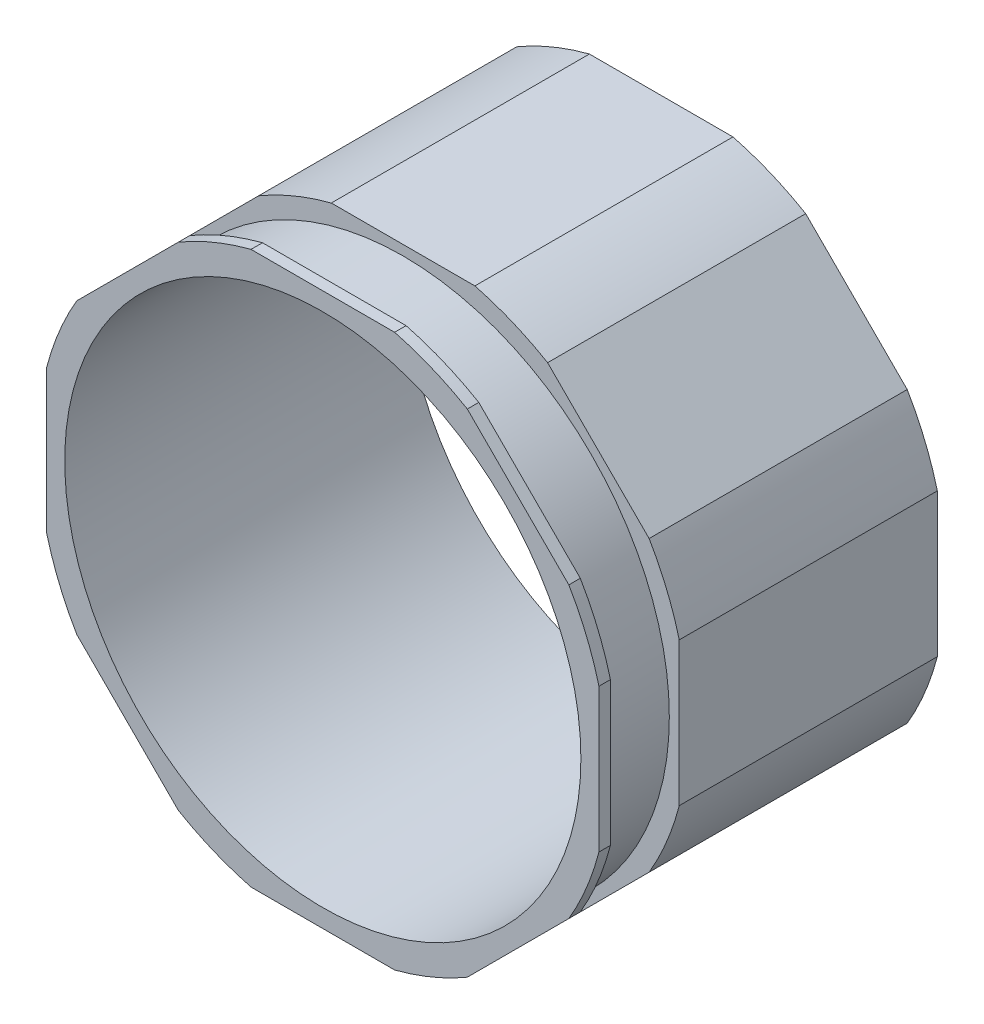
from build123d import *

# Parameters (mm, degrees)
SKETCH1_R           = 114.3
BOSS_EXTRUDE1_DEPTH = 114.3
SKETCH2_R           = 117.9068
SKETCH2_R_2         = 114.3
BOSS_EXTRUDE2_DEPTH = 30.48
SKETCH3_R           = 114.3
BOSS_EXTRUDE3_DEPTH = 5.08


with BuildPart() as part:
    # Sketch1 → Boss-Extrude1 (new body)
    with BuildSketch(Plane.XY):
        with BuildLine():
            ThreePointArc((-31.793446259, 122.3), (-48.357791931, 116.746037126), (-63.997797892, 108.960520786))
            Line((-63.997797892, 108.960520786), (-108.960520786, 63.997797892))
            ThreePointArc((-108.960520786, 63.997797892), (-116.746037126, 48.357791931), (-122.3, 31.793446259))
            Line((-122.3, 31.793446259), (-122.3, -31.793446259))
            ThreePointArc((-122.3, -31.793446259), (-116.746037126, -48.357791931), (-108.960520786, -63.997797892))
            Line((-108.960520786, -63.997797892), (-63.997797892, -108.960520786))
            ThreePointArc((-63.997797892, -108.960520786), (-48.357791931, -116.746037126), (-31.793446259, -122.3))
            Line((-31.793446259, -122.3), (31.793446259, -122.3))
            ThreePointArc((31.793446259, -122.3), (48.357791931, -116.746037126), (63.997797892, -108.960520786))
            Line((63.997797892, -108.960520786), (108.960520786, -63.997797892))
            ThreePointArc((108.960520786, -63.997797892), (116.746037126, -48.357791931), (122.3, -31.793446259))
            Line((122.3, -31.793446259), (122.3, 31.793446259))
            ThreePointArc((122.3, 31.793446259), (116.746037126, 48.357791931), (108.960520786, 63.997797892))
            Line((108.960520786, 63.997797892), (63.997797892, 108.960520786))
            ThreePointArc((63.997797892, 108.960520786), (48.357791931, 116.746037126), (31.793446259, 122.3))
            Line((31.793446259, 122.3), (-31.793446259, 122.3))
        make_face()
        Circle(SKETCH1_R, mode=Mode.SUBTRACT)
    extrude(amount=BOSS_EXTRUDE1_DEPTH)

    # Sketch2 → Boss-Extrude2 (add)
    with BuildSketch(Plane.XY.offset(114.3)):
        with Locations(Location((0, 0, 0), (0, 0, 180))):
            Circle(SKETCH2_R)
        Circle(SKETCH2_R_2, mode=Mode.SUBTRACT)
    extrude(amount=BOSS_EXTRUDE2_DEPTH)

    # Sketch3 → Boss-Extrude3 (add)
    with BuildSketch(Plane.XY.offset(144.78)):
        with BuildLine():
            Line((122.3, -31.793446259), (122.3, 31.793446259))
            ThreePointArc((122.3, 31.793446259), (116.746037126, 48.357791931), (108.960520786, 63.997797892))
            Line((108.960520786, 63.997797892), (63.997797892, 108.960520786))
            ThreePointArc((63.997797892, 108.960520786), (48.357791931, 116.746037126), (31.793446259, 122.3))
            Line((31.793446259, 122.3), (-31.793446259, 122.3))
            ThreePointArc((-31.793446259, 122.3), (-48.357791931, 116.746037126), (-63.997797892, 108.960520786))
            Line((-63.997797892, 108.960520786), (-108.960520786, 63.997797892))
            ThreePointArc((-108.960520786, 63.997797892), (-116.746037126, 48.357791931), (-122.3, 31.793446259))
            Line((-122.3, 31.793446259), (-122.3, -31.793446259))
            ThreePointArc((-122.3, -31.793446259), (-116.746037126, -48.357791931), (-108.960520786, -63.997797892))
            Line((-108.960520786, -63.997797892), (-63.997797892, -108.960520786))
            ThreePointArc((-63.997797892, -108.960520786), (-48.357791931, -116.746037126), (-31.793446259, -122.3))
            Line((-31.793446259, -122.3), (31.793446259, -122.3))
            ThreePointArc((31.793446259, -122.3), (48.357791931, -116.746037126), (63.997797892, -108.960520786))
            Line((63.997797892, -108.960520786), (108.960520786, -63.997797892))
            ThreePointArc((108.960520786, -63.997797892), (116.746037126, -48.357791931), (122.3, -31.793446259))
        make_face()
        Circle(SKETCH3_R, mode=Mode.SUBTRACT)
    extrude(amount=BOSS_EXTRUDE3_DEPTH)


solid = part.part
